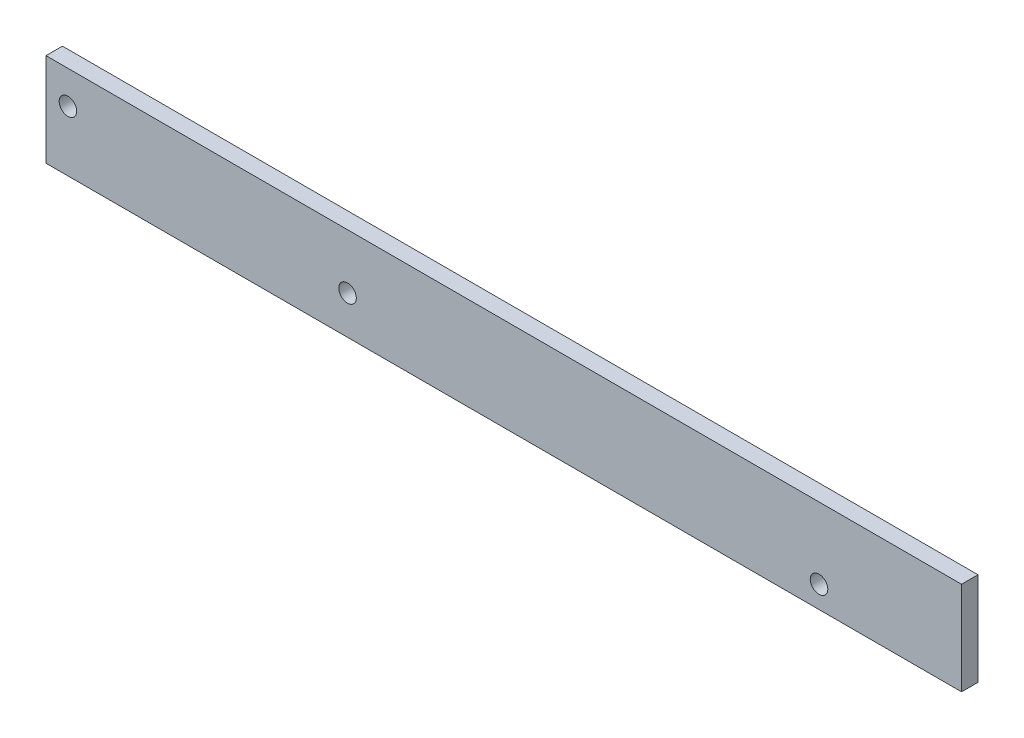
from build123d import *

# Parameters (mm, degrees)
ESQUISSE1_W        = 167
ESQUISSE1_H        = 17
BOSS_EXTRU_1_DEPTH = 3
SKETCH1_R          = 1.6
CUT_EXTRUDE1_DEPTH = 102.899460254
SKETCH2_R          = 1.6
CUT_EXTRUDE2_DEPTH = 102.899460254
SKETCH3_R          = 1.6
CUT_EXTRUDE3_DEPTH = 102.899460254


with BuildPart() as part:
    # Esquisse1 → Boss.-Extru.1 (new body)
    with BuildSketch(Plane.XY):
        with Locations((18, 0)):
            Rectangle(ESQUISSE1_W, ESQUISSE1_H)
    extrude(amount=BOSS_EXTRU_1_DEPTH)

    # Sketch1 → Cut-Extrude1 (cut, through all)
    with BuildSketch(Plane.XY.offset(3)):
        with Locations((-61.5, 2.5)):
            Circle(SKETCH1_R)
    extrude(amount=-CUT_EXTRUDE1_DEPTH, mode=Mode.SUBTRACT)

    # Sketch2 → Cut-Extrude2 (cut, through all)
    with BuildSketch(Plane(origin=(0, 0, 0), x_dir=(-1, 0, 0), z_dir=(0, 0, -1))):
        with Locations((-75.5, -4.5)):
            Circle(SKETCH2_R)
    extrude(amount=-CUT_EXTRUDE2_DEPTH, mode=Mode.SUBTRACT)

    # Sketch3 → Cut-Extrude3 (cut, through all)
    with BuildSketch(Plane.XY.offset(3)):
        with Locations((-10.5, -1.5)):
            Circle(SKETCH3_R)
    extrude(amount=-CUT_EXTRUDE3_DEPTH, mode=Mode.SUBTRACT)


solid = part.part
